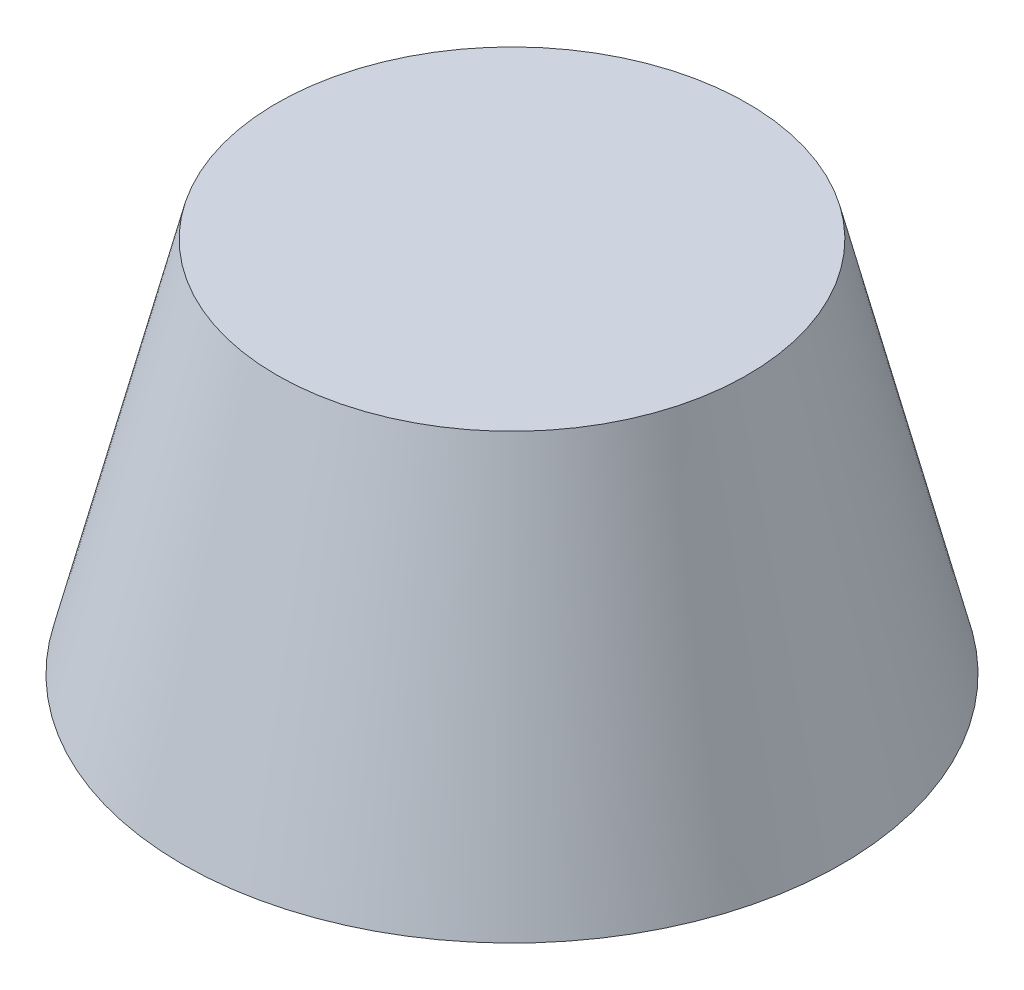
from build123d import *

# Parameters (mm, degrees)
SKETCH1_R = 22.225
SKETCH2_R = 15.875


with BuildPart() as part:
    # Sketch1 → Loft1 section 0
    with BuildSketch(Plane(origin=(0, 0, 0), x_dir=(1, 0, 0), z_dir=(0, 1, 0))):
        Circle(SKETCH1_R)
    # Sketch2 → Loft1 section 1
    with BuildSketch(Plane(origin=(0, 25.4, 0), x_dir=(1, 0, 0), z_dir=(0, 1, 0))):
        Circle(SKETCH2_R)
    loft()


solid = part.part
